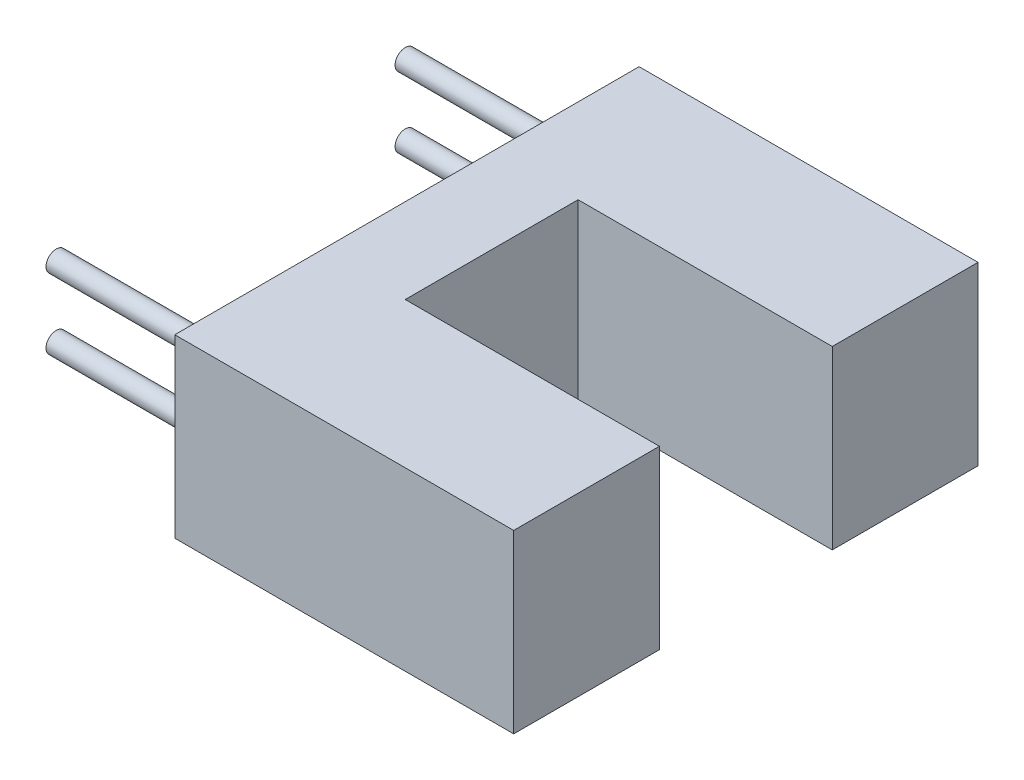
from build123d import *

# Parameters (mm, degrees)
BOSS_EXTRUDE1_DEPTH = 5.2
SKETCH2_R           = 0.3
BOSS_EXTRUDE2_DEPTH = 5.2


with BuildPart() as part:
    # Sketch1 → Boss-Extrude1 (new body)
    with BuildSketch(Plane(origin=(0, 0, 0), x_dir=(1, 0, 0), z_dir=(0, 1, 0))):
        Polygon((0, 0), (0, 13.7), (10, 13.7), (10, 9.4), (2.5, 9.4), (2.5, 4.3), (10, 4.3), (10, 0), align=None)
    extrude(amount=BOSS_EXTRUDE1_DEPTH)

    # Sketch2 → Boss-Extrude2 (add)
    with BuildSketch(Plane.ZY):
        with Locations(Location((-12, 3.64, 0), (0, 0, 180))):
            Circle(SKETCH2_R)
        with Locations(Location((-1.7, 3.64, 0), (0, 0, 180))):
            Circle(SKETCH2_R)
        with Locations(Location((-1.7, 1.56, 0), (0, 0, 180))):
            Circle(SKETCH2_R)
        with Locations(Location((-12, 1.56, 0), (0, 0, 180))):
            Circle(SKETCH2_R)
    extrude(amount=BOSS_EXTRUDE2_DEPTH)


solid = part.part
